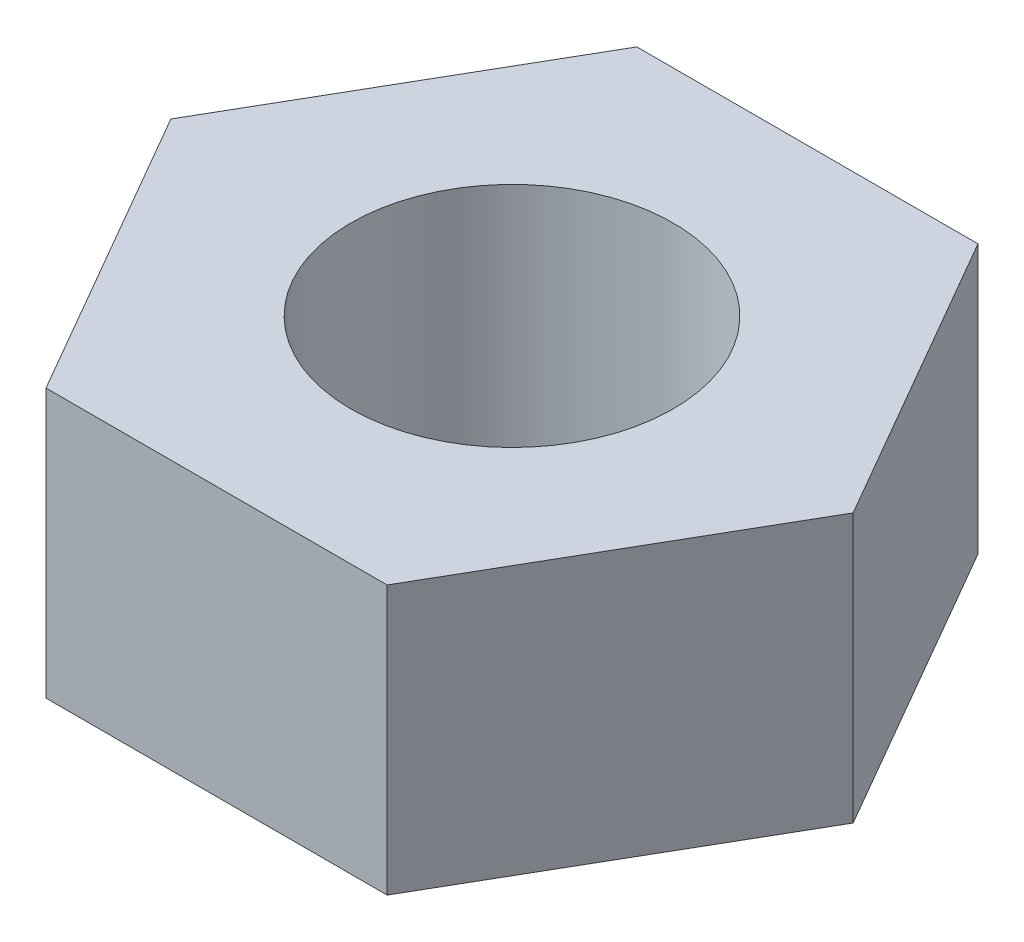
from build123d import *

# Parameters (mm, degrees)
SKETCH1_R           = 1.5
BOSS_EXTRUDE1_DEPTH = 2.5


with BuildPart() as part:
    # Sketch1 → Boss-Extrude1 (new body)
    with BuildSketch(Plane(origin=(0, 0, 0), x_dir=(1, 0, 0), z_dir=(0, 1, 0))):
        Polygon((1.58771324, 2.75), (-1.58771324, 2.75), (-3.175426481, 0), (-1.58771324, -2.75), (1.58771324, -2.75), (3.175426481, 0), align=None)
        with Locations(Location((0, 0, 0), (0, 0, 270))):
            Circle(SKETCH1_R, mode=Mode.SUBTRACT)
    extrude(amount=BOSS_EXTRUDE1_DEPTH)


solid = part.part
